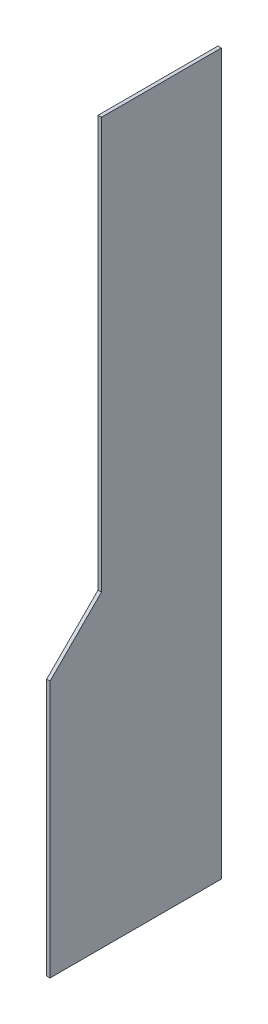
from build123d import *

# Parameters (mm, degrees)
EXTRUDE_1_DEPTH = 10


with BuildPart() as part:
    # Эскиз1 → Бобышка-Вытянуть1 (new body)
    with BuildSketch(Plane(origin=(0, 0, 0), x_dir=(0, 0, -1), z_dir=(1, 0, 0))):
        Polygon((0, 750), (150, 900), (150, 2000), (150, 2100), (250, 2100), (500, 2100), (500, 0), (0, 0), align=None)
    extrude(amount=EXTRUDE_1_DEPTH)


solid = part.part
